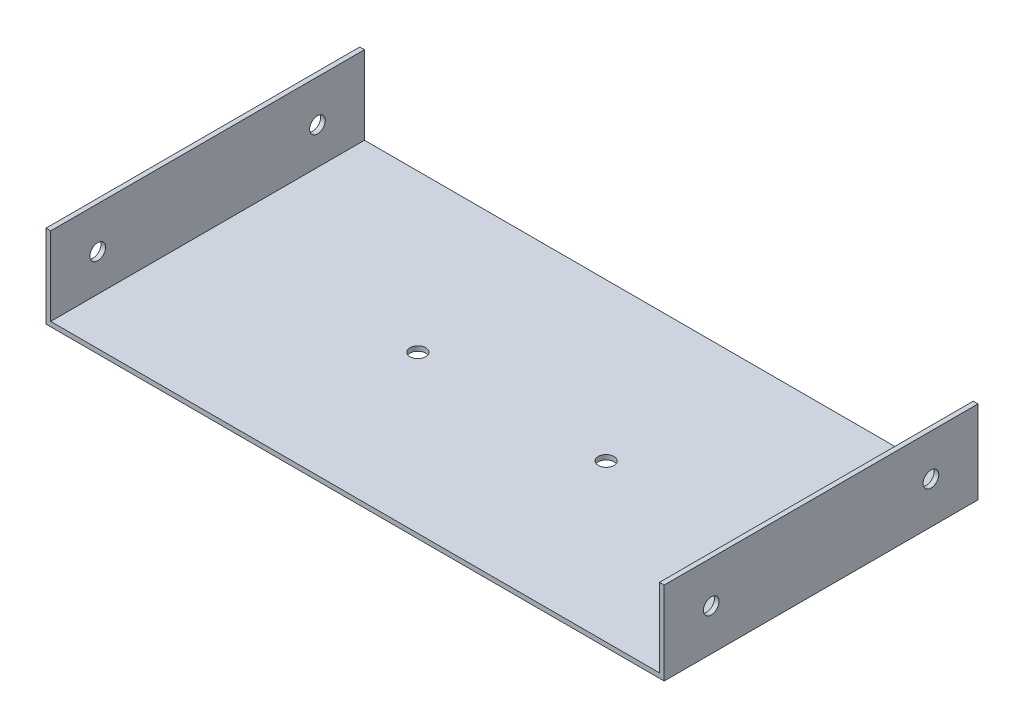
from build123d import *

# Parameters (mm, degrees)
SKETCH1_W           = 394
SKETCH1_H           = 200
BOSS_EXTRUDE1_DEPTH = 3
SKETCH2_W           = 3
SKETCH2_H           = 200
BOSS_EXTRUDE2_DEPTH = 50
SKETCH3_R           = 5
CUT_EXTRUDE1_DEPTH  = 410.932921342
SKETCH4_R           = 5
CUT_EXTRUDE2_DEPTH  = 228.195950668


with BuildPart() as part:
    # Sketch1 → Boss-Extrude1 (new body)
    with BuildSketch(Plane(origin=(0, 0, 0), x_dir=(1, 0, 0), z_dir=(0, 1, 0))):
        Rectangle(SKETCH1_W, SKETCH1_H)
    extrude(amount=BOSS_EXTRUDE1_DEPTH)

    # Sketch2 → Boss-Extrude2 (add)
    with BuildSketch(Plane(origin=(0, 3, 0), x_dir=(1, 0, 0), z_dir=(0, 1, 0))):
        with Locations((-195.5, 0)):
            Rectangle(SKETCH2_W, SKETCH2_H)
        with Locations((195.5, 0)):
            Rectangle(SKETCH2_W, SKETCH2_H)
    extrude(amount=BOSS_EXTRUDE2_DEPTH)

    # Sketch3 → Cut-Extrude1 (cut, through all)
    with BuildSketch(Plane(origin=(197, 0, 0), x_dir=(0, 0, -1), z_dir=(1, 0, 0))):
        with Locations((70, 26.5)):
            Circle(SKETCH3_R)
        with Locations((-70, 26.5)):
            Circle(SKETCH3_R)
    extrude(amount=-CUT_EXTRUDE1_DEPTH, mode=Mode.SUBTRACT)

    # Sketch4 → Cut-Extrude2 (cut, through all)
    with BuildSketch(Plane.XZ):
        with Locations(Location((60, 0, 0), (0, 0, 270))):
            Circle(SKETCH4_R)
        with Locations(Location((-60, 0, 0), (0, 0, 270))):
            Circle(SKETCH4_R)
    extrude(amount=-CUT_EXTRUDE2_DEPTH, mode=Mode.SUBTRACT)


solid = part.part
